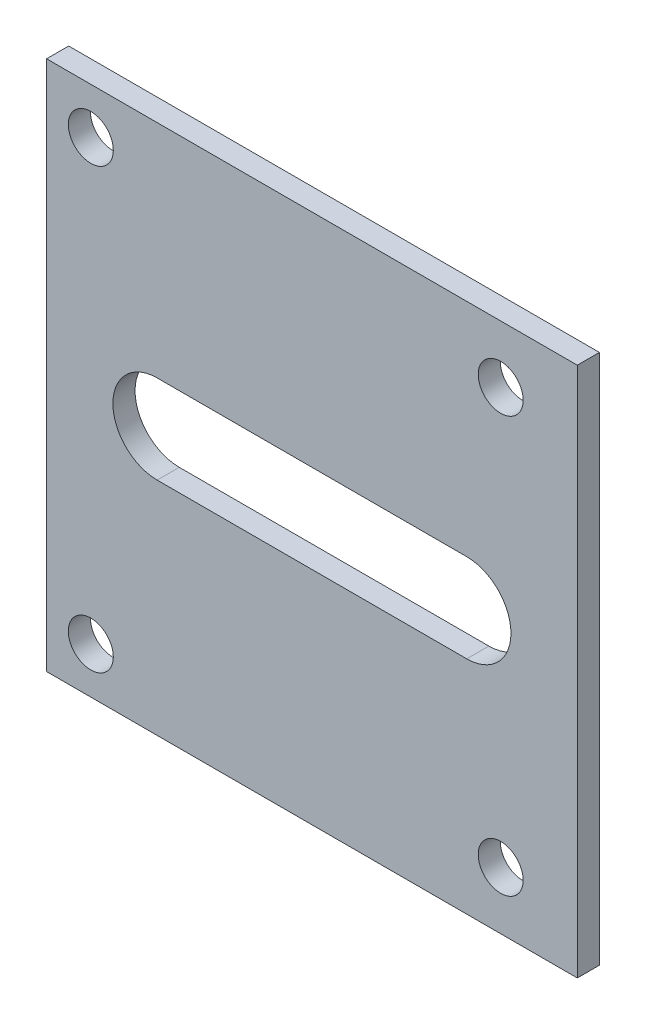
from build123d import *

# Parameters (mm, degrees)
SKETCH1_W           = 76.2
SKETCH1_H           = 76.2
SKETCH1_R           = 3.229097739
BOSS_EXTRUDE3_DEPTH = 3.175
CUT_EXTRUDE1_DEPTH  = 3.175


with BuildPart() as part:
    # Sketch1 → Boss-Extrude3 (new body)
    with BuildSketch(Plane.XY):
        with Locations((38.1, 38.1)):
            Rectangle(SKETCH1_W, SKETCH1_H)
        with Locations((6.35, 69.596)):
            Circle(SKETCH1_R, mode=Mode.SUBTRACT)
        with Locations((6.35, 6.604)):
            Circle(SKETCH1_R, mode=Mode.SUBTRACT)
        with Locations((65.2018, 67.945)):
            Circle(SKETCH1_R, mode=Mode.SUBTRACT)
        with Locations((65.2018, 8.255)):
            Circle(SKETCH1_R, mode=Mode.SUBTRACT)
    extrude(amount=BOSS_EXTRUDE3_DEPTH)

    # Sketch2 → Cut-Extrude1 (cut)
    with BuildSketch(Plane.XY.offset(3.175)):
        with BuildLine():
            Line((15.875, 44.45), (60.325, 44.45))
            ThreePointArc((60.325, 44.45), (66.675, 38.1), (60.325, 31.75))
            Line((60.325, 31.75), (15.875, 31.75))
            ThreePointArc((15.875, 31.75), (9.525, 38.1), (15.875, 44.45))
        make_face()
    extrude(amount=-CUT_EXTRUDE1_DEPTH, mode=Mode.SUBTRACT)


solid = part.part
